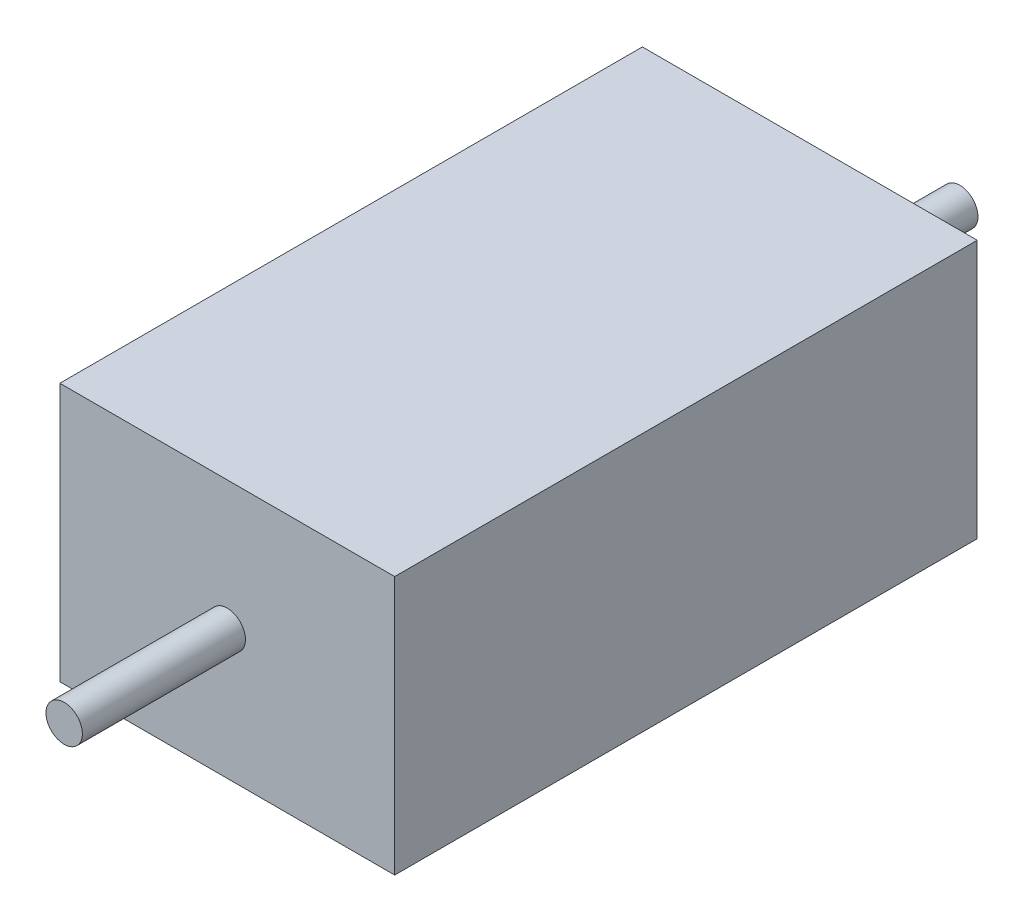
from build123d import *

# Parameters (mm, degrees)
SKETCH1_W                = 229.923881951
SKETCH1_H                = 177.514761801
BOSS_EXTRUDE1_DEPTH      = 400
BOSS_EXTRUDE2_DEPTH      = 112
BOSS_EXTRUDE2_DEPTH_BACK = 503
SKETCH2_R                = 12.5


with BuildPart() as part:
    # Sketch1 → Boss-Extrude1 (new body)
    with BuildSketch(Plane.XY):
        with Locations((144.662099629, -170.086101065)):
            Rectangle(SKETCH1_W, SKETCH1_H)
    extrude(amount=BOSS_EXTRUDE1_DEPTH)

    # Sketch2 → Boss-Extrude2 (add, two sides: drawn at the far end of the back side and taken through both)
    with BuildSketch(Plane.XY.offset(400).offset(-BOSS_EXTRUDE2_DEPTH_BACK)):
        with Locations((144.662099628, -170.086101065)):
            Circle(SKETCH2_R)
    extrude(amount=BOSS_EXTRUDE2_DEPTH + BOSS_EXTRUDE2_DEPTH_BACK)


solid = part.part
